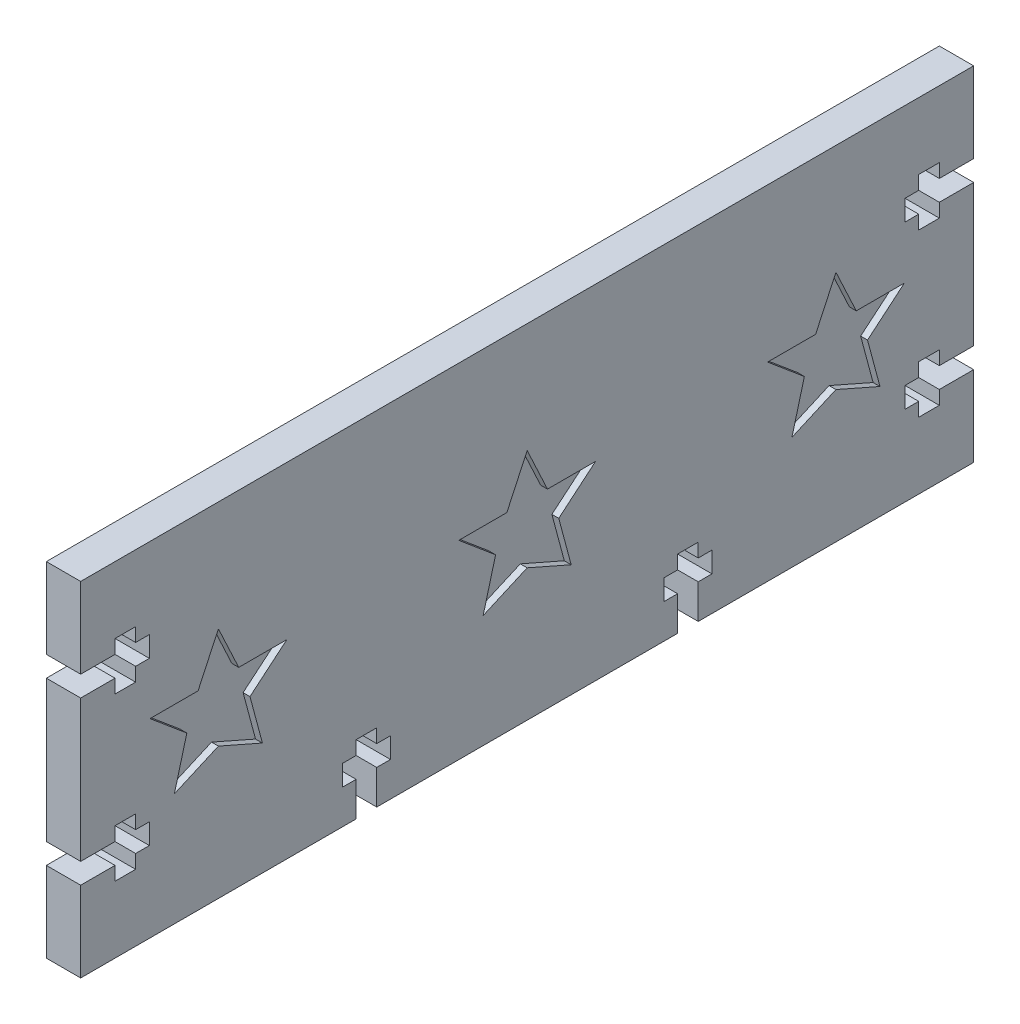
from build123d import *

# Parameters (mm, degrees)
BOSS_EXTRUDE1_DEPTH = 6.35
CUT_EXTRUDE1_DEPTH  = 178.004470283
CUT_EXTRUDE2_DEPTH  = 1.27


with BuildPart() as part:
    # Sketch1 → Boss-Extrude1 (new body)
    with BuildSketch(Plane(origin=(0, 0, 0), x_dir=(0, 0, -1), z_dir=(1, 0, 0))):
        Polygon((0, 0), (165.1, 0), (165.1, -14.859), (158.75, -14.859), (158.75, -12.319), (154.94, -12.319), (154.94, -14.859), (152.4, -14.859), (152.4, -18.669), (154.94, -18.669), (154.94, -21.209), (158.75, -21.209), (158.75, -18.669), (165.1, -18.669), (165.1, -44.831), (158.75, -44.831), (158.75, -42.291), (154.94, -42.291), (154.94, -44.831), (152.4, -44.831), (152.4, -48.641), (154.94, -48.641), (154.94, -51.181), (158.75, -51.181), (158.75, -48.641), (165.1, -48.641), (165.1, -63.5), (0, -63.5), (0, -48.641), (6.35, -48.641), (6.35, -51.181), (10.16, -51.181), (10.16, -48.641), (12.7, -48.641), (12.7, -44.831), (10.16, -44.831), (10.16, -42.291), (6.35, -42.291), (6.35, -44.831), (0, -44.831), (0, -18.669), (6.35, -18.669), (6.35, -21.209), (10.16, -21.209), (10.16, -18.669), (12.7, -18.669), (12.7, -14.859), (10.16, -14.859), (10.16, -12.319), (6.35, -12.319), (6.35, -14.859), (0, -14.859), align=None)
    extrude(amount=BOSS_EXTRUDE1_DEPTH)

    # Sketch2 → Cut-Extrude1 (cut, through all)
    with BuildSketch(Plane(origin=(6.35, 0, 0), x_dir=(0, 0, -1), z_dir=(1, 0, 0))):
        Polygon((50.927, -63.5), (54.737, -63.5), (54.737, -57.15), (57.277, -57.15), (57.277, -53.34), (54.737, -53.34), (54.737, -50.8), (50.927, -50.8), (50.927, -53.34), (48.387, -53.34), (48.387, -57.15), (50.927, -57.15), align=None)
        Polygon((110.363, -63.5), (114.173, -63.5), (114.173, -57.15), (116.713, -57.15), (116.713, -53.34), (114.173, -53.34), (114.173, -50.8), (110.363, -50.8), (110.363, -53.34), (107.823, -53.34), (107.823, -57.15), (110.363, -57.15), align=None)
    extrude(amount=-CUT_EXTRUDE1_DEPTH, mode=Mode.SUBTRACT)

    # Sketch3 → Cut-Extrude2 (cut)
    with BuildSketch(Plane(origin=(6.35, 0, 0), x_dir=(0, 0, -1), z_dir=(1, 0, 0))):
        Polygon((82.55, -20.32), (78.792923653, -28.377076227), (69.902923653, -28.377076227), (76.713058752, -34.091458077), (74.412157441, -42.678538673), (82.55, -39.09976535), (90.687842559, -42.678538673), (88.386941248, -34.091458077), (95.197076347, -28.377076227), (86.307076347, -28.377076227), align=None)
        Polygon((25.4635, -20.32), (21.706423653, -28.377076227), (12.816423653, -28.377076227), (19.626558752, -34.091458077), (17.325657441, -42.678538673), (25.4635, -39.09976535), (33.601342559, -42.678538673), (31.300441248, -34.091458077), (38.110576347, -28.377076227), (29.220576347, -28.377076227), align=None)
        Polygon((139.6365, -20.32), (135.879423653, -28.377076227), (126.989423653, -28.377076227), (133.799558752, -34.091458077), (131.498657441, -42.678538673), (139.6365, -39.09976535), (147.774342559, -42.678538673), (145.473441248, -34.091458077), (152.283576347, -28.377076227), (143.393576347, -28.377076227), align=None)
    extrude(amount=-CUT_EXTRUDE2_DEPTH, mode=Mode.SUBTRACT)


solid = part.part
